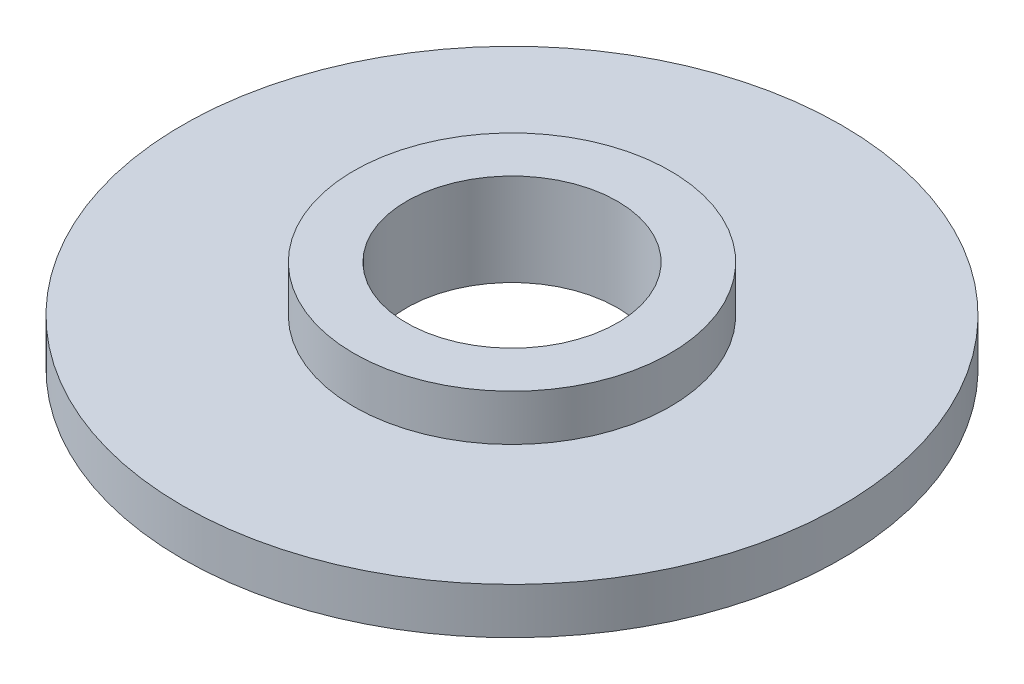
from build123d import *

# Parameters (mm, degrees)
SKETCH1_R           = 12.5
SKETCH1_R_2         = 4
BOSS_EXTRUDE1_DEPTH = 3.5
CUT_EXTRUDE1_START  = -1.75
SKETCH3_R           = 12.5
SKETCH3_R_2         = 6
CUT_EXTRUDE1_DEPTH  = 1.75


with BuildPart() as part:
    # Sketch1 → Boss-Extrude1 (new body)
    with BuildSketch(Plane(origin=(0, 0, 0), x_dir=(1, 0, 0), z_dir=(0, 1, 0))):
        with Locations(Location((0, 0, 0), (0, 0, 90))):
            Circle(SKETCH1_R)
        with Locations(Location((0, 0, 0), (0, 0, 90))):
            Circle(SKETCH1_R_2, mode=Mode.SUBTRACT)
    extrude(amount=BOSS_EXTRUDE1_DEPTH)

    # Sketch3 → Cut-Extrude1 (cut)
    with BuildSketch(Plane(origin=(0, 3.5, 0), x_dir=(1, 0, 0), z_dir=(0, 1, 0)).offset(CUT_EXTRUDE1_START)):
        with Locations(Location((0, 0, 0), (0, 0, 90))):
            Circle(SKETCH3_R)
        with Locations(Location((0, 0, 0), (0, 0, 270))):
            Circle(SKETCH3_R_2, mode=Mode.SUBTRACT)
    extrude(amount=CUT_EXTRUDE1_DEPTH, mode=Mode.SUBTRACT)


solid = part.part
